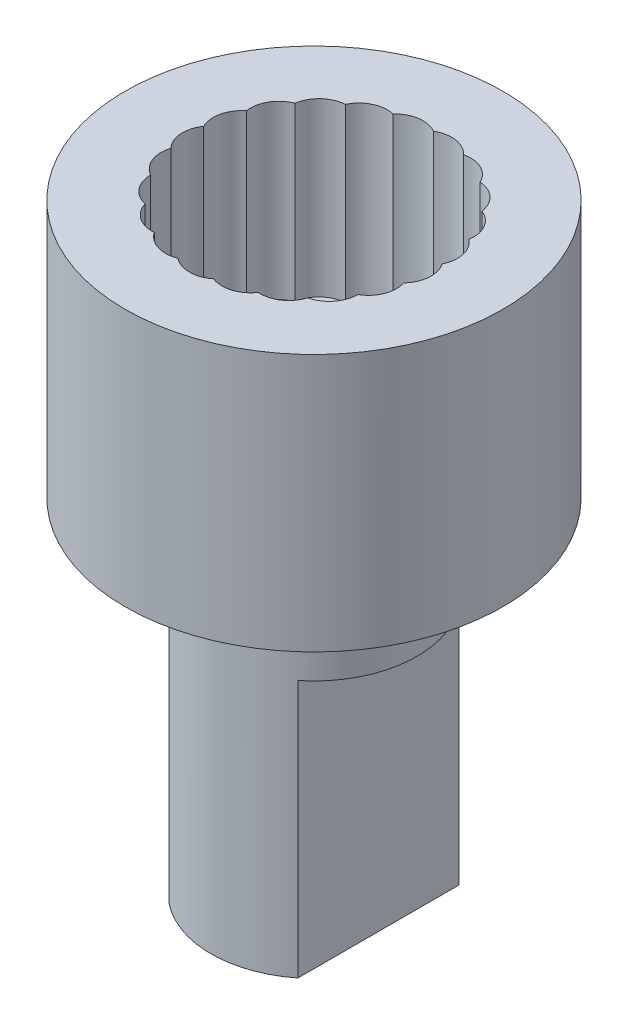
from build123d import *

# Parameters (mm, degrees)
SKETCH1_R           = 3.95
BOSS_EXTRUDE1_DEPTH = 4
SKETCH2_R           = 4.4
BOSS_EXTRUDE2_DEPTH = 2
SKETCH4_R           = 2.4
BOSS_EXTRUDE3_DEPTH = 2
BOSS_EXTRUDE4_DEPTH = 6
SKETCH6_R           = 4.4
SKETCH6_R_2         = 3.95
BOSS_EXTRUDE5_DEPTH = 4
CUT_EXTRUDE1_START  = -4
CUT_EXTRUDE1_DEPTH  = 4
CUT_EXTRUDE2_START  = -4
CUT_EXTRUDE2_DEPTH  = 4
BOSS_EXTRUDE6_START = -4
BOSS_EXTRUDE6_DEPTH = 4


with BuildPart() as part:
    # Sketch1 → Boss-Extrude1 (new body)
    with BuildSketch(Plane(origin=(0, 0, 0), x_dir=(1, 0, 0), z_dir=(0, 1, 0))):
        Circle(SKETCH1_R)
        with BuildLine():
            ThreePointArc((-0.166646614, 2.345141313), (-0.092401566, 2.286261662), (0, 2.2652595))
            ThreePointArc((0, 2.2652595), (0.092401566, 2.286261662), (0.166646614, 2.345141313))
            ThreePointArc((0.166646614, 2.345141313), (0.365153552, 2.422635524), (0.531999564, 2.290073216))
            ThreePointArc((0.531999564, 2.290073216), (0.585591031, 2.211925311), (0.667696959, 2.164620376))
            ThreePointArc((0.667696959, 2.164620376), (0.762183879, 2.157453631), (0.850485509, 2.191833312))
            ThreePointArc((0.850485509, 2.191833312), (1.063015161, 2.207373726), (1.183375246, 2.031522064))
            ThreePointArc((1.183375246, 2.031522064), (1.211551295, 1.941049689), (1.276066113, 1.871645232))
            ThreePointArc((1.276066113, 1.871645232), (1.364242809, 1.836946378), (1.458755034, 1.843771303))
            ThreePointArc((1.458755034, 1.843771303), (1.666423208, 1.795977086), (1.729602845, 1.592461261))
            ThreePointArc((1.729602845, 1.592461261), (1.72985991, 1.497703284), (1.771051193, 1.412366197))
            ThreePointArc((1.771051193, 1.412366197), (1.845082779, 1.353218377), (1.937407773, 1.331882123))
            ThreePointArc((1.937407773, 1.331882123), (2.121762239, 1.225), (2.12214764, 1.011903287))
            ThreePointArc((2.12214764, 1.011903287), (2.094462881, 0.92127937), (2.108670602, 0.827592226))
            ThreePointArc((2.108670602, 0.827592226), (2.161979047, 0.749250985), (2.243913329, 0.701649371))
            ThreePointArc((2.243913329, 0.701649371), (2.388573385, 0.545176288), (2.326130305, 0.341433266))
            ThreePointArc((2.326130305, 0.341433266), (2.272963633, 0.262995741), (2.258925375, 0.169283054))
            ThreePointArc((2.258925375, 0.169283054), (2.286773988, 0.078709355), (2.351037339, 0.009071994))
            ThreePointArc((2.351037339, 0.009071994), (2.443149303, -0.183088729), (2.323426084, -0.3593746))
            ThreePointArc((2.323426084, -0.3593746), (2.249501592, -0.418656214), (2.208464714, -0.504067659))
            ThreePointArc((2.208464714, -0.504067659), (2.208379026, -0.598825947), (2.249261363, -0.68431147))
            ThreePointArc((2.249261363, -0.68431147), (2.280640684, -0.89508551), (2.114275259, -1.028250455))
            ThreePointArc((2.114275259, -1.028250455), (2.026161462, -1.063108727), (1.961772273, -1.13262975))
            ThreePointArc((1.961772273, -1.13262975), (1.933759896, -1.223152935), (1.947628645, -1.316890857))
            ThreePointArc((1.947628645, -1.316890857), (1.915487132, -1.527550015), (1.717261799, -1.605761745))
            ThreePointArc((1.717261799, -1.605761745), (1.622787995, -1.613099364), (1.540767756, -1.660552716))
            ThreePointArc((1.540767756, -1.660552716), (1.487317713, -1.738797417), (1.472940575, -1.832458712))
            ThreePointArc((1.472940575, -1.832458712), (1.380134142, -2.024284997), (1.167662092, -2.040594058))
            ThreePointArc((1.167662092, -2.040594058), (1.075222693, -2.019759044), (0.982859262, -2.040928287))
            ThreePointArc((0.982859262, -2.040928287), (0.908720824, -2.099942118), (0.86737527, -2.185204569))
            ThreePointArc((0.86737527, -2.185204569), (0.722150177, -2.341153374), (0.514310485, -2.294110633))
            ThreePointArc((0.514310485, -2.294110633), (0.432119136, -2.246954269), (0.337619409, -2.239958423))
            ThreePointArc((0.337619409, -2.239958423), (0.249380102, -2.274497747), (0.184739867, -2.343785411))
            ThreePointArc((0.184739867, -2.343785411), (0, -2.45), (-0.184739867, -2.343785411))
            ThreePointArc((-0.184739867, -2.343785411), (-0.249380102, -2.274497747), (-0.337619409, -2.239958423))
            ThreePointArc((-0.337619409, -2.239958423), (-0.432119136, -2.246954269), (-0.514310485, -2.294110633))
            ThreePointArc((-0.514310485, -2.294110633), (-0.722150177, -2.341153374), (-0.86737527, -2.185204569))
            ThreePointArc((-0.86737527, -2.185204569), (-0.908720824, -2.099942118), (-0.982859262, -2.040928287))
            ThreePointArc((-0.982859262, -2.040928287), (-1.075222693, -2.019759044), (-1.167662092, -2.040594058))
            ThreePointArc((-1.167662092, -2.040594058), (-1.380134142, -2.024284997), (-1.472940575, -1.832458712))
            ThreePointArc((-1.472940575, -1.832458712), (-1.487317713, -1.738797417), (-1.540767756, -1.660552716))
            ThreePointArc((-1.540767756, -1.660552716), (-1.622787995, -1.613099364), (-1.717261799, -1.605761745))
            ThreePointArc((-1.717261799, -1.605761745), (-1.915487132, -1.527550015), (-1.947628645, -1.316890857))
            ThreePointArc((-1.947628645, -1.316890857), (-1.933759896, -1.223152935), (-1.961772273, -1.13262975))
            ThreePointArc((-1.961772273, -1.13262975), (-2.026161462, -1.063108727), (-2.114275259, -1.028250455))
            ThreePointArc((-2.114275259, -1.028250455), (-2.280640684, -0.89508551), (-2.249261363, -0.68431147))
            ThreePointArc((-2.249261363, -0.68431147), (-2.208379026, -0.598825947), (-2.208464714, -0.504067659))
            ThreePointArc((-2.208464714, -0.504067659), (-2.249501592, -0.418656214), (-2.323426084, -0.3593746))
            ThreePointArc((-2.323426084, -0.3593746), (-2.443149303, -0.183088729), (-2.351037339, 0.009071994))
            ThreePointArc((-2.351037339, 0.009071994), (-2.286773988, 0.078709355), (-2.258925375, 0.169283054))
            ThreePointArc((-2.258925375, 0.169283054), (-2.272963633, 0.262995741), (-2.326130305, 0.341433266))
            ThreePointArc((-2.326130305, 0.341433266), (-2.388573385, 0.545176288), (-2.243913329, 0.701649371))
            ThreePointArc((-2.243913329, 0.701649371), (-2.161979047, 0.749250985), (-2.108670602, 0.827592226))
            ThreePointArc((-2.108670602, 0.827592226), (-2.094462881, 0.92127937), (-2.12214764, 1.011903287))
            ThreePointArc((-2.12214764, 1.011903287), (-2.121762239, 1.225), (-1.937407773, 1.331882123))
            ThreePointArc((-1.937407773, 1.331882123), (-1.845082779, 1.353218377), (-1.771051193, 1.412366197))
            ThreePointArc((-1.771051193, 1.412366197), (-1.72985991, 1.497703284), (-1.729602845, 1.592461261))
            ThreePointArc((-1.729602845, 1.592461261), (-1.666423208, 1.795977086), (-1.458755034, 1.843771303))
            ThreePointArc((-1.458755034, 1.843771303), (-1.364242809, 1.836946378), (-1.276066113, 1.871645232))
            ThreePointArc((-1.276066113, 1.871645232), (-1.211551295, 1.941049689), (-1.183375246, 2.031522064))
            ThreePointArc((-1.183375246, 2.031522064), (-1.063015161, 2.207373726), (-0.850485509, 2.191833312))
            ThreePointArc((-0.850485509, 2.191833312), (-0.762183879, 2.157453631), (-0.667696959, 2.164620376))
            ThreePointArc((-0.667696959, 2.164620376), (-0.585591031, 2.211925311), (-0.531999564, 2.290073216))
            ThreePointArc((-0.531999564, 2.290073216), (-0.365153552, 2.422635524), (-0.166646614, 2.345141313))
        make_face(mode=Mode.SUBTRACT)
    extrude(amount=BOSS_EXTRUDE1_DEPTH)

    # Sketch2 → Boss-Extrude2 (add)
    with BuildSketch(Plane.XZ):
        Circle(SKETCH2_R)
    extrude(amount=BOSS_EXTRUDE2_DEPTH)

    # Sketch4 → Boss-Extrude3 (add)
    with BuildSketch(Plane.XZ.offset(2)):
        Circle(SKETCH4_R)
    extrude(amount=BOSS_EXTRUDE3_DEPTH)

    # Sketch5 → Boss-Extrude4 (add)
    with BuildSketch(Plane.XZ.offset(4)):
        with BuildLine():
            ThreePointArc((1.5, 1.8734994), (0, 2.4), (-1.5, 1.8734994))
            Line((-1.5, 1.8734994), (-1.5, -1.8734994))
            ThreePointArc((-1.5, -1.8734994), (0, -2.4), (1.5, -1.8734994))
            Line((1.5, -1.8734994), (1.5, 1.8734994))
        make_face()
    extrude(amount=BOSS_EXTRUDE4_DEPTH)

    # Sketch6 → Boss-Extrude5 (add)
    with BuildSketch(Plane(origin=(0, 0, 0), x_dir=(1, 0, 0), z_dir=(0, 1, 0))):
        Circle(SKETCH6_R)
        Circle(SKETCH6_R_2, mode=Mode.SUBTRACT)
    extrude(amount=BOSS_EXTRUDE5_DEPTH)

    # Sketch8 → Cut-Extrude1 (cut)
    with BuildSketch(Plane(origin=(0, 4, 0), x_dir=(1, 0, 0), z_dir=(0, 1, 0)).offset(CUT_EXTRUDE1_START)):
        with BuildLine():
            ThreePointArc((2.526654558, 0.189346583), (2.629361338, 0.382268482), (2.632305363, 0.600806522))
            ThreePointArc((2.632305363, 0.600806522), (2.534832787, 0.796425127), (2.3585915, 0.92567895))
            ThreePointArc((2.3585915, 0.92567895), (2.33826859, 1.35), (1.980957237, 1.579760681))
            ThreePointArc((1.980957237, 1.579760681), (1.836466392, 1.979240054), (1.42730623, 2.093473742))
            ThreePointArc((1.42730623, 2.093473742), (1.171486096, 2.432615943), (0.746832801, 2.421172474))
            ThreePointArc((0.746832801, 2.421172474), (0.402414119, 2.669843231), (0, 2.533739407))
            ThreePointArc((0, 2.533739407), (-0.402414119, 2.669843231), (-0.746832801, 2.421172474))
            ThreePointArc((-0.746832801, 2.421172474), (-1.171486096, 2.432615943), (-1.42730623, 2.093473742))
            ThreePointArc((-1.42730623, 2.093473742), (-1.836466392, 1.979240054), (-1.980957237, 1.579760681))
            ThreePointArc((-1.980957237, 1.579760681), (-2.33826859, 1.35), (-2.3585915, 0.92567895))
            ThreePointArc((-2.3585915, 0.92567895), (-2.632305363, 0.600806522), (-2.526654558, 0.189346583))
            ThreePointArc((-2.526654558, 0.189346583), (-2.692450252, -0.201771253), (-2.47021327, -0.563810059))
            ThreePointArc((-2.47021327, -0.563810059), (-2.513359121, -0.986420766), (-2.194282693, -1.266869704))
            ThreePointArc((-2.194282693, -1.266869704), (-2.110945003, -1.683422465), (-1.723380469, -1.857362415))
            ThreePointArc((-1.723380469, -1.857362415), (-1.520964157, -2.230844691), (-1.099348328, -2.282820325))
            ThreePointArc((-1.099348328, -2.282820325), (-0.795838971, -2.580046576), (-0.377634263, -2.505439631))
            ThreePointArc((-0.377634263, -2.505439631), (0, -2.7), (0.377634263, -2.505439631))
            ThreePointArc((0.377634263, -2.505439631), (0.795838971, -2.580046576), (1.099348328, -2.282820325))
            ThreePointArc((1.099348328, -2.282820325), (1.520964157, -2.230844691), (1.723380469, -1.857362415))
            ThreePointArc((1.723380469, -1.857362415), (2.110945003, -1.683422465), (2.194282693, -1.266869704))
            ThreePointArc((2.194282693, -1.266869704), (2.513359121, -0.986420766), (2.47021327, -0.563810059))
            ThreePointArc((2.47021327, -0.563810059), (2.692450252, -0.201771253), (2.526654558, 0.189346583))
        make_face()
        with BuildLine():
            ThreePointArc((2.243913329, 0.701649371), (2.337130966, 0.642723516), (2.388573385, 0.545176288))
            ThreePointArc((2.388573385, 0.545176288), (2.384549523, 0.434969243), (2.326130305, 0.341433266))
            ThreePointArc((2.326130305, 0.341433266), (2.258925375, 0.169283054), (2.351037339, 0.009071994))
            ThreePointArc((2.351037339, 0.009071994), (2.443149303, -0.183088729), (2.323426084, -0.3593746))
            ThreePointArc((2.323426084, -0.3593746), (2.208464714, -0.504067659), (2.249261363, -0.68431147))
            ThreePointArc((2.249261363, -0.68431147), (2.280640684, -0.89508551), (2.114275259, -1.028250455))
            ThreePointArc((2.114275259, -1.028250455), (1.961772273, -1.13262975), (1.947628645, -1.316890857))
            ThreePointArc((1.947628645, -1.316890857), (1.915487132, -1.527550015), (1.717261799, -1.605761745))
            ThreePointArc((1.717261799, -1.605761745), (1.540767756, -1.660552716), (1.472940575, -1.832458712))
            ThreePointArc((1.472940575, -1.832458712), (1.380134142, -2.024284997), (1.167662092, -2.040594058))
            ThreePointArc((1.167662092, -2.040594058), (0.982859262, -2.040928287), (0.86737527, -2.185204569))
            ThreePointArc((0.86737527, -2.185204569), (0.722150177, -2.341153374), (0.514310485, -2.294110633))
            ThreePointArc((0.514310485, -2.294110633), (0.337619409, -2.239958423), (0.184739867, -2.343785411))
            ThreePointArc((0.184739867, -2.343785411), (0, -2.45), (-0.184739867, -2.343785411))
            ThreePointArc((-0.184739867, -2.343785411), (-0.337619409, -2.239958423), (-0.514310485, -2.294110633))
            ThreePointArc((-0.514310485, -2.294110633), (-0.722150177, -2.341153374), (-0.86737527, -2.185204569))
            ThreePointArc((-0.86737527, -2.185204569), (-0.982859262, -2.040928287), (-1.167662092, -2.040594058))
            ThreePointArc((-1.167662092, -2.040594058), (-1.380134142, -2.024284997), (-1.472940575, -1.832458712))
            ThreePointArc((-1.472940575, -1.832458712), (-1.540767756, -1.660552716), (-1.717261799, -1.605761745))
            ThreePointArc((-1.717261799, -1.605761745), (-1.915487132, -1.527550015), (-1.947628645, -1.316890857))
            ThreePointArc((-1.947628645, -1.316890857), (-1.961772273, -1.13262975), (-2.114275259, -1.028250455))
            ThreePointArc((-2.114275259, -1.028250455), (-2.280640684, -0.89508551), (-2.249261363, -0.68431147))
            ThreePointArc((-2.249261363, -0.68431147), (-2.208464714, -0.504067659), (-2.323426084, -0.3593746))
            ThreePointArc((-2.323426084, -0.3593746), (-2.443149303, -0.183088729), (-2.351037339, 0.009071994))
            ThreePointArc((-2.351037339, 0.009071994), (-2.258925375, 0.169283054), (-2.326130305, 0.341433266))
            ThreePointArc((-2.326130305, 0.341433266), (-2.388573385, 0.545176288), (-2.243913329, 0.701649371))
            ThreePointArc((-2.243913329, 0.701649371), (-2.108670602, 0.827592226), (-2.12214764, 1.011903287))
            ThreePointArc((-2.12214764, 1.011903287), (-2.121762239, 1.225), (-1.937407773, 1.331882123))
            ThreePointArc((-1.937407773, 1.331882123), (-1.771051193, 1.412366197), (-1.729602845, 1.592461261))
            ThreePointArc((-1.729602845, 1.592461261), (-1.666423208, 1.795977086), (-1.458755034, 1.843771303))
            ThreePointArc((-1.458755034, 1.843771303), (-1.276066113, 1.871645232), (-1.183375246, 2.031522064))
            ThreePointArc((-1.183375246, 2.031522064), (-1.063015161, 2.207373726), (-0.850485509, 2.191833312))
            ThreePointArc((-0.850485509, 2.191833312), (-0.667696959, 2.164620376), (-0.531999564, 2.290073216))
            ThreePointArc((-0.531999564, 2.290073216), (-0.365153552, 2.422635524), (-0.166646614, 2.345141313))
            ThreePointArc((-0.166646614, 2.345141313), (0, 2.2652595), (0.166646614, 2.345141313))
            ThreePointArc((0.166646614, 2.345141313), (0.365153552, 2.422635524), (0.531999564, 2.290073216))
            ThreePointArc((0.531999564, 2.290073216), (0.667696959, 2.164620376), (0.850485509, 2.191833312))
            ThreePointArc((0.850485509, 2.191833312), (1.063015161, 2.207373726), (1.183375246, 2.031522064))
            ThreePointArc((1.183375246, 2.031522064), (1.276066113, 1.871645232), (1.458755034, 1.843771303))
            ThreePointArc((1.458755034, 1.843771303), (1.666423208, 1.795977086), (1.729602845, 1.592461261))
            ThreePointArc((1.729602845, 1.592461261), (1.771051193, 1.412366197), (1.937407773, 1.331882123))
            ThreePointArc((1.937407773, 1.331882123), (2.121762239, 1.225), (2.12214764, 1.011903287))
            ThreePointArc((2.12214764, 1.011903287), (2.108670602, 0.827592226), (2.243913329, 0.701649371))
        make_face(mode=Mode.SUBTRACT)
    extrude(amount=CUT_EXTRUDE1_DEPTH, mode=Mode.SUBTRACT)

    # Sketch8<3> → Cut-Extrude2 (cut)
    with BuildSketch(Plane(origin=(0, 4, 0), x_dir=(1, 0, 0), z_dir=(0, 1, 0)).offset(CUT_EXTRUDE2_START)):
        with BuildLine():
            ThreePointArc((-1.755056494, 2.574195088), (-2.176552761, 2.34576599), (-2.43584158, 1.94251884))
            ThreePointArc((-2.43584158, 1.94251884), (-2.771281292, 1.6), (-2.900191453, 1.138241268))
            ThreePointArc((-2.900191453, 1.138241268), (-3.119769319, 0.712066989), (-3.106846588, 0.232825965))
            ThreePointArc((-3.106846588, 0.232825965), (-3.191052151, -0.239136299), (-3.037444769, -0.693276947))
            ThreePointArc((-3.037444769, -0.693276947), (-2.978795996, -1.169091278), (-2.698152653, -1.55777916))
            ThreePointArc((-2.698152653, -1.55777916), (-2.501860744, -1.995167366), (-2.119117833, -2.283865859))
            ThreePointArc((-2.119117833, -2.283865859), (-1.802624186, -2.643964078), (-1.351790094, -2.807021053))
            ThreePointArc((-1.351790094, -2.807021053), (-0.943216558, -3.057832979), (-0.464349872, -3.080760108))
            ThreePointArc((-0.464349872, -3.080760108), (0, -3.2), (0.464349872, -3.080760108))
            ThreePointArc((0.464349872, -3.080760108), (0.943216558, -3.057832979), (1.351790094, -2.807021053))
            ThreePointArc((1.351790094, -2.807021053), (1.802624186, -2.643964078), (2.119117833, -2.283865859))
            ThreePointArc((2.119117833, -2.283865859), (2.501860744, -1.995167366), (2.698152653, -1.55777916))
            ThreePointArc((2.698152653, -1.55777916), (2.978795996, -1.169091278), (3.037444769, -0.693276947))
            ThreePointArc((3.037444769, -0.693276947), (3.191052151, -0.239136299), (3.106846588, 0.232825965))
            ThreePointArc((3.106846588, 0.232825965), (3.119769319, 0.712066989), (2.900191453, 1.138241268))
            ThreePointArc((2.900191453, 1.138241268), (2.771281292, 1.6), (2.43584158, 1.94251884))
            ThreePointArc((2.43584158, 1.94251884), (2.176552761, 2.34576599), (1.755056494, 2.574195088))
            ThreePointArc((1.755056494, 2.574195088), (1.388427965, 2.883100377), (0.918326936, 2.977142806))
            ThreePointArc((0.918326936, 2.977142806), (0.476935252, 3.164258644), (0, 3.11555832))
            ThreePointArc((0, 3.11555832), (-0.476935252, 3.164258644), (-0.918326936, 2.977142806))
            ThreePointArc((-0.918326936, 2.977142806), (-1.388427965, 2.883100377), (-1.755056494, 2.574195088))
        make_face()
        with BuildLine():
            ThreePointArc((2.3585915, 0.92567895), (2.534832787, 0.796425127), (2.632305363, 0.600806522))
            ThreePointArc((2.632305363, 0.600806522), (2.629361338, 0.382268482), (2.526654558, 0.189346583))
            ThreePointArc((2.526654558, 0.189346583), (2.692450252, -0.201771253), (2.47021327, -0.563810059))
            ThreePointArc((2.47021327, -0.563810059), (2.513359121, -0.986420766), (2.194282693, -1.266869704))
            ThreePointArc((2.194282693, -1.266869704), (2.110945003, -1.683422465), (1.723380469, -1.857362415))
            ThreePointArc((1.723380469, -1.857362415), (1.520964157, -2.230844691), (1.099348328, -2.282820325))
            ThreePointArc((1.099348328, -2.282820325), (0.795838971, -2.580046576), (0.377634263, -2.505439631))
            ThreePointArc((0.377634263, -2.505439631), (0, -2.7), (-0.377634263, -2.505439631))
            ThreePointArc((-0.377634263, -2.505439631), (-0.795838971, -2.580046576), (-1.099348328, -2.282820325))
            ThreePointArc((-1.099348328, -2.282820325), (-1.520964157, -2.230844691), (-1.723380469, -1.857362415))
            ThreePointArc((-1.723380469, -1.857362415), (-2.110945003, -1.683422465), (-2.194282693, -1.266869704))
            ThreePointArc((-2.194282693, -1.266869704), (-2.513359121, -0.986420766), (-2.47021327, -0.563810059))
            ThreePointArc((-2.47021327, -0.563810059), (-2.692450252, -0.201771253), (-2.526654558, 0.189346583))
            ThreePointArc((-2.526654558, 0.189346583), (-2.632305363, 0.600806522), (-2.3585915, 0.92567895))
            ThreePointArc((-2.3585915, 0.92567895), (-2.33826859, 1.35), (-1.980957237, 1.579760681))
            ThreePointArc((-1.980957237, 1.579760681), (-1.836466392, 1.979240054), (-1.42730623, 2.093473742))
            ThreePointArc((-1.42730623, 2.093473742), (-1.171486096, 2.432615943), (-0.746832801, 2.421172474))
            ThreePointArc((-0.746832801, 2.421172474), (-0.402414119, 2.669843231), (0, 2.533739407))
            ThreePointArc((0, 2.533739407), (0.402414119, 2.669843231), (0.746832801, 2.421172474))
            ThreePointArc((0.746832801, 2.421172474), (1.171486096, 2.432615943), (1.42730623, 2.093473742))
            ThreePointArc((1.42730623, 2.093473742), (1.836466392, 1.979240054), (1.980957237, 1.579760681))
            ThreePointArc((1.980957237, 1.579760681), (2.33826859, 1.35), (2.3585915, 0.92567895))
        make_face(mode=Mode.SUBTRACT)
    extrude(amount=CUT_EXTRUDE2_DEPTH, mode=Mode.SUBTRACT)

    # Sketch9 → Boss-Extrude6 (add)
    with BuildSketch(Plane(origin=(0, 4, 0), x_dir=(1, 0, 0), z_dir=(0, 1, 0)).offset(BOSS_EXTRUDE6_START)):
        with BuildLine():
            ThreePointArc((-0.918326936, 2.977142806), (-1.388427965, 2.883100377), (-1.755056494, 2.574195088))
            ThreePointArc((-1.755056494, 2.574195088), (-2.176552761, 2.34576599), (-2.43584158, 1.94251884))
            ThreePointArc((-2.43584158, 1.94251884), (-2.771281292, 1.6), (-2.900191453, 1.138241268))
            ThreePointArc((-2.900191453, 1.138241268), (-3.119769319, 0.712066989), (-3.106846588, 0.232825965))
            ThreePointArc((-3.106846588, 0.232825965), (-3.191052151, -0.239136299), (-3.037444769, -0.693276947))
            ThreePointArc((-3.037444769, -0.693276947), (-2.978795996, -1.169091278), (-2.698152653, -1.55777916))
            ThreePointArc((-2.698152653, -1.55777916), (-2.501860744, -1.995167366), (-2.119117833, -2.283865859))
            ThreePointArc((-2.119117833, -2.283865859), (-1.802624186, -2.643964078), (-1.351790094, -2.807021053))
            ThreePointArc((-1.351790094, -2.807021053), (-0.943216558, -3.057832979), (-0.464349872, -3.080760108))
            ThreePointArc((-0.464349872, -3.080760108), (0, -3.2), (0.464349872, -3.080760108))
            ThreePointArc((0.464349872, -3.080760108), (0.943216558, -3.057832979), (1.351790094, -2.807021053))
            ThreePointArc((1.351790094, -2.807021053), (1.802624186, -2.643964078), (2.119117833, -2.283865859))
            ThreePointArc((2.119117833, -2.283865859), (2.501860744, -1.995167366), (2.698152653, -1.55777916))
            ThreePointArc((2.698152653, -1.55777916), (2.978795996, -1.169091278), (3.037444769, -0.693276947))
            ThreePointArc((3.037444769, -0.693276947), (3.191052151, -0.239136299), (3.106846588, 0.232825965))
            ThreePointArc((3.106846588, 0.232825965), (3.119769319, 0.712066989), (2.900191453, 1.138241268))
            ThreePointArc((2.900191453, 1.138241268), (2.771281292, 1.6), (2.43584158, 1.94251884))
            ThreePointArc((2.43584158, 1.94251884), (2.176552761, 2.34576599), (1.755056494, 2.574195088))
            ThreePointArc((1.755056494, 2.574195088), (1.388427965, 2.883100377), (0.918326936, 2.977142806))
            ThreePointArc((0.918326936, 2.977142806), (0.476935252, 3.164258644), (0, 3.11555832))
            ThreePointArc((0, 3.11555832), (-0.476935252, 3.164258644), (-0.918326936, 2.977142806))
        make_face()
        with BuildLine():
            ThreePointArc((-0.820975398, 2.661536871), (-1.258262843, 2.612809717), (-1.569003529, 2.301305509))
            ThreePointArc((-1.569003529, 2.301305509), (-1.97250094, 2.125850428), (-2.177618811, 1.736593053))
            ThreePointArc((-2.177618811, 1.736593053), (-2.511473671, 1.45), (-2.592743105, 1.017576684))
            ThreePointArc((-2.592743105, 1.017576684), (-2.827290945, 0.645310708), (-2.777490797, 0.20814416))
            ThreePointArc((-2.777490797, 0.20814416), (-2.891891012, -0.216717271), (-2.715446242, -0.619782885))
            ThreePointArc((-2.715446242, -0.619782885), (-2.699533871, -1.059488971), (-2.412122372, -1.392639501))
            ThreePointArc((-2.412122372, -1.392639501), (-2.267311299, -1.808120425), (-1.894470844, -2.041753986))
            ThreePointArc((-1.894470844, -2.041753986), (-1.633628168, -2.396092446), (-1.208487268, -2.509449669))
            ThreePointArc((-1.208487268, -2.509449669), (-0.854790006, -2.771161137), (-0.415124294, -2.754169737))
            ThreePointArc((-0.415124294, -2.754169737), (0, -2.9), (0.415124294, -2.754169737))
            ThreePointArc((0.415124294, -2.754169737), (0.854790006, -2.771161137), (1.208487268, -2.509449669))
            ThreePointArc((1.208487268, -2.509449669), (1.633628168, -2.396092446), (1.894470844, -2.041753986))
            ThreePointArc((1.894470844, -2.041753986), (2.267311299, -1.808120425), (2.412122372, -1.392639501))
            ThreePointArc((2.412122372, -1.392639501), (2.699533871, -1.059488971), (2.715446242, -0.619782885))
            ThreePointArc((2.715446242, -0.619782885), (2.891891012, -0.216717271), (2.777490797, 0.20814416))
            ThreePointArc((2.777490797, 0.20814416), (2.827290945, 0.645310708), (2.592743105, 1.017576684))
            ThreePointArc((2.592743105, 1.017576684), (2.511473671, 1.45), (2.177618811, 1.736593053))
            ThreePointArc((2.177618811, 1.736593053), (1.97250094, 2.125850428), (1.569003529, 2.301305509))
            ThreePointArc((1.569003529, 2.301305509), (1.258262843, 2.612809717), (0.820975398, 2.661536871))
            ThreePointArc((0.820975398, 2.661536871), (0.432222572, 2.867609396), (0, 2.785279002))
            ThreePointArc((0, 2.785279002), (-0.432222572, 2.867609396), (-0.820975398, 2.661536871))
        make_face(mode=Mode.SUBTRACT)
    extrude(amount=BOSS_EXTRUDE6_DEPTH)


solid = part.part
